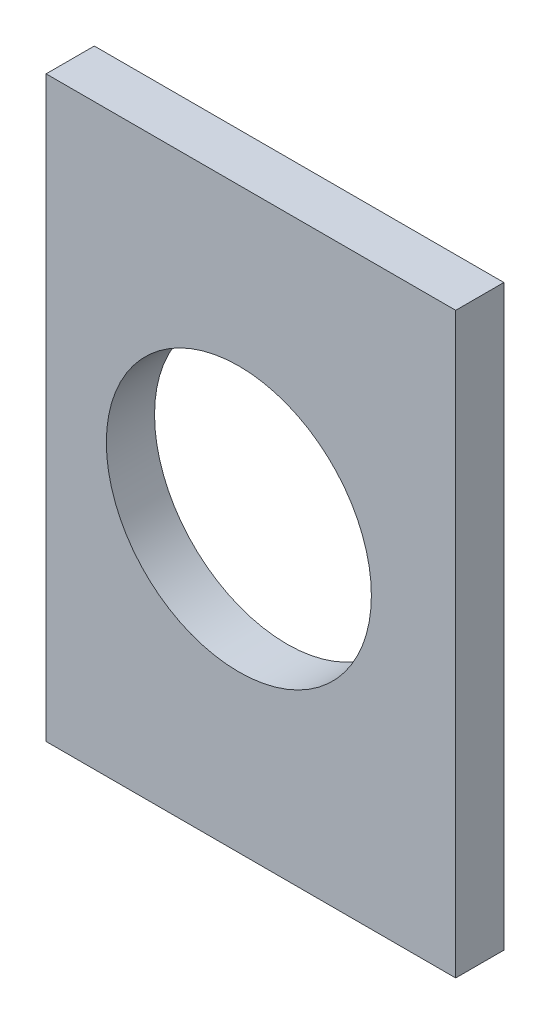
from build123d import *

# Parameters (mm, degrees)
M5_FLOOR_ATTACHMENT_PROFILE_W = 8.5
M5_FLOOR_ATTACHMENT_PROFILE_H = 12
M5_FLOOR_ATTACHMENT_PROFILE_R = 2.75
M5_FLOOR_ATTACHMENT_DEPTH     = 1


with BuildPart() as part:
    # M5 floor attachment profile → M5 floor attachment (new body)
    with BuildSketch(Plane.XY):
        with Locations((98.75, 0)):
            Rectangle(M5_FLOOR_ATTACHMENT_PROFILE_W, M5_FLOOR_ATTACHMENT_PROFILE_H)
        with Locations((98.5, 0)):
            Circle(M5_FLOOR_ATTACHMENT_PROFILE_R, mode=Mode.SUBTRACT)
    extrude(amount=M5_FLOOR_ATTACHMENT_DEPTH)


solid = part.part
